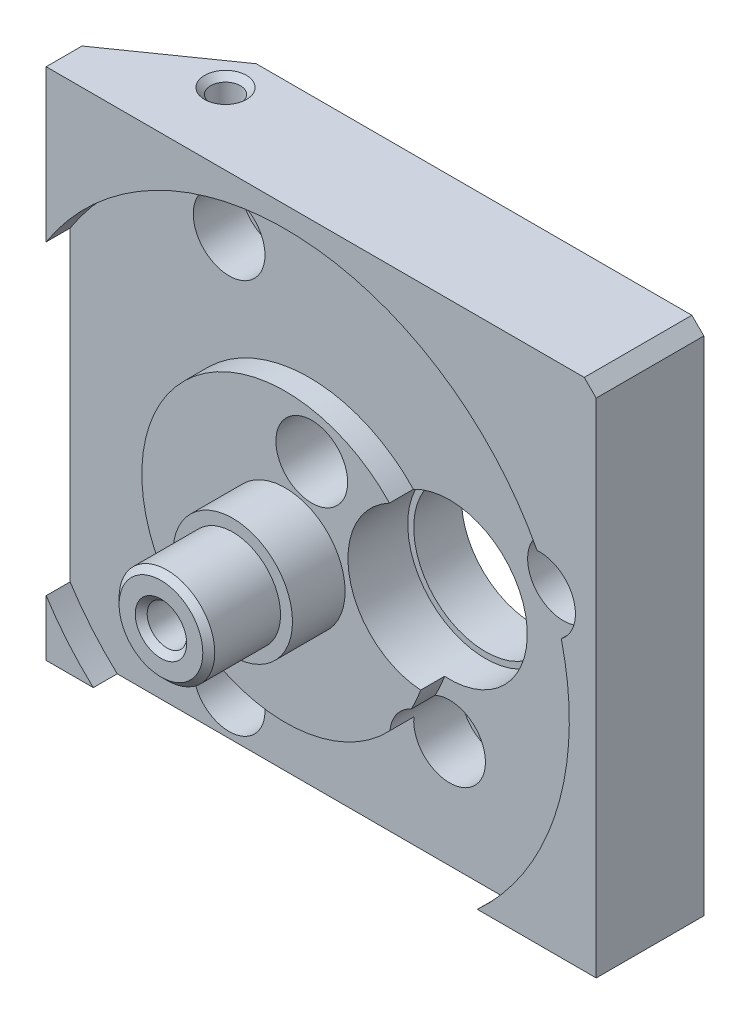
from build123d import *

# Parameters (mm, degrees)
SKETCH_1_W                 = 52
SKETCH_1_H                 = 45
EXTRUDE_1_DEPTH            = 9
SKETCH_19_R                = 23.75
SKETCH_19_R_2              = 12
CUT_EXTRUDE_2_DEPTH        = 2
SKETCH_20_R                = 5
EXTRUDE_3_DEPTH            = 4.4
SKETCH_21_R                = 4
EXTRUDE_4_DEPTH            = 6
SKETCH_22_R                = 6
CUT_EXTRUDE_5_DEPTH        = 36.922277211
HOLE_WIZARD_1_D            = 3.4
HOLE_WIZARD_1_CBORE_D      = 6
HOLE_WIZARD_1_CBORE_DEPTH  = 6
CUT_EXTRUDE_6_DEPTH        = 45
HOLE_WIZARD_M3_1_D         = 2.5
HOLE_WIZARD_M3_1_DEPTH     = 9.5
HOLE_WIZARD_M3_1_TIP       = 0.751075774
HOLE_WIZARD_M4_2_D         = 3.3
HOLE_WIZARD_M4_2_DEPTH     = 10.1
HOLE_WIZARD_M4_2_TIP       = 0.991420021
CHAMFER_3_SIZE             = 0.5
M3_TAPPED_HOLE2_D          = 2.5
M3_TAPPED_HOLE2_DEPTH      = 11.5
M3_TAPPED_HOLE2_TIP        = 0.751075774
CHAMFER_4_SIZE             = 0.5
CHAMFER_5_SIZE             = 0.5
CHAMFER_6_SIZE             = 1
HOLE_WIZARD_2_D            = 3.4
HOLE_WIZARD_2_CBORE_D      = 6
HOLE_WIZARD_2_CBORE_DEPTH  = 6
EXTRUDE3_DEPTH             = 2
CHAMFER3_SIZE              = 0.5
EXTRUDE4_REACH             = 55.864
SKETCH_34_R                = 1
CUT_EXTRUDE_1_DEPTH        = 4
CUT_EXTRUDE_2_2_DEPTH      = 6
CUT_EXTRUDE_2_2_DEPTH_BACK = 3
SKETCH_35_R                = 6.5


with BuildPart() as part:
    # 草图1 → 拉伸1 (new body)
    with BuildSketch(Plane.XY):
        Rectangle(SKETCH_1_W, SKETCH_1_H)
    extrude(amount=EXTRUDE_1_DEPTH)

    # 草图19 → Cut-Extrude 2 (cut)
    with BuildSketch(Plane.XY.offset(9)):
        with Locations((0, -3)):
            Circle(SKETCH_19_R)
        with Locations((0, -3)):
            Circle(SKETCH_19_R_2, mode=Mode.SUBTRACT)
    extrude(amount=-CUT_EXTRUDE_2_DEPTH, mode=Mode.SUBTRACT)

    # 草图20 → 拉伸3 (add)
    with BuildSketch(Plane.XY.offset(9)):
        with Locations((0, -3)):
            Circle(SKETCH_20_R)
    extrude(amount=EXTRUDE_3_DEPTH)

    # 草图21 → 拉伸4 (add)
    with BuildSketch(Plane.XY.offset(13.4)):
        with Locations((0, -3)):
            Circle(SKETCH_21_R)
    extrude(amount=EXTRUDE_4_DEPTH)

    # 草图22 → 拉伸5 (cut, through all)
    with BuildSketch(Plane.XY.offset(9)):
        with Locations((11.736694594, -0.5)):
            Circle(SKETCH_22_R)
    extrude(amount=-CUT_EXTRUDE_5_DEPTH, mode=Mode.SUBTRACT)

    # 打孔尺寸根据内六角圆柱头螺钉的类型1 (through all)
    with Locations(Plane(origin=(2.210415153, 5, 9), x_dir=(1, 0, 0), z_dir=(0, 0, 1))):
        with Locations((0, 0), (9.526279441, -16.5), (19.052558883, 0)):
            CounterBoreHole(HOLE_WIZARD_1_D / 2, HOLE_WIZARD_1_CBORE_D / 2, HOLE_WIZARD_1_CBORE_DEPTH)

    # 草图25 → 拉伸6 (cut)
    with BuildSketch(Plane.XZ.offset(22.5)):
        Polygon((-26, 8), (-14.574815946, 0), (-26, 0), align=None)
    extrude(amount=-CUT_EXTRUDE_6_DEPTH, mode=Mode.SUBTRACT)

    # M3 螺纹孔1
    with Locations(Plane(origin=(-11, 22.5, 3), x_dir=(0, 0, 1), z_dir=(0, 1, 0))):
        with Locations((0, 0)):
            Hole(HOLE_WIZARD_M3_1_D / 2, depth=HOLE_WIZARD_M3_1_DEPTH)
            with Locations((0, 0, -(HOLE_WIZARD_M3_1_DEPTH + HOLE_WIZARD_M3_1_TIP / 2))):  # 118° drill point
                Cone(0, HOLE_WIZARD_M3_1_D / 2, HOLE_WIZARD_M3_1_TIP, mode=Mode.SUBTRACT)

    # M4 螺纹孔2
    with Locations(Plane(origin=(0, -3, 19.4), x_dir=(1, 0, 0), z_dir=(0, 0, 1))):
        with Locations((0, 0)):
            Hole(HOLE_WIZARD_M4_2_D / 2, depth=HOLE_WIZARD_M4_2_DEPTH)
            with Locations((0, 0, -(HOLE_WIZARD_M4_2_DEPTH + HOLE_WIZARD_M4_2_TIP / 2))):  # 118° drill point
                Cone(0, HOLE_WIZARD_M4_2_D / 2, HOLE_WIZARD_M4_2_TIP, mode=Mode.SUBTRACT)

    # 倒角3
    chamfer_3_edges = [part.edges().sort_by_distance(p)[0] for p in [
        (-4, -3, 19.4),
        (1.65, -3, 19.4),
    ]]
    chamfer(chamfer_3_edges, length=CHAMFER_3_SIZE)

    # M3 Tapped Hole2
    with Locations(Plane(origin=(-11, -22.5, 3), x_dir=(0, 0, -1), z_dir=(0, -1, 0))):
        with Locations((0, 0), (0, 35)):
            Hole(M3_TAPPED_HOLE2_D / 2, depth=M3_TAPPED_HOLE2_DEPTH)
            with Locations((0, 0, -(M3_TAPPED_HOLE2_DEPTH + M3_TAPPED_HOLE2_TIP / 2))):  # 118° drill point
                Cone(0, M3_TAPPED_HOLE2_D / 2, M3_TAPPED_HOLE2_TIP, mode=Mode.SUBTRACT)

    # 倒角4
    chamfer_4_edges = [part.edges().sort_by_distance(p)[0] for p in [
        (-11, -22.5, 1.75),
        (-11, 22.5, 4.25),
    ]]
    chamfer(chamfer_4_edges, length=CHAMFER_4_SIZE)

    # 倒角5
    chamfer_5_edges = [part.edges().sort_by_distance(p)[0] for p in [
        (24, -22.5, 1.75),
    ]]
    chamfer(chamfer_5_edges, length=CHAMFER_5_SIZE)

    # 倒角6
    chamfer_6_edges = [part.edges().sort_by_distance(p)[0] for p in [
        (26, 22.5, 4.5),
    ]]
    chamfer(chamfer_6_edges, length=CHAMFER_6_SIZE)

    # 打孔尺寸根据内六角圆柱头螺钉的类型2 (through all)
    with Locations(Plane(origin=(-6.7, 16, 9), x_dir=(1, 0, 0), z_dir=(0, 0, 1))):
        with Locations((0, 0), (0, -33)):
            CounterBoreHole(HOLE_WIZARD_2_D / 2, HOLE_WIZARD_2_CBORE_D / 2, HOLE_WIZARD_2_CBORE_DEPTH)

    # Sketch6 → Extrude3 (cut)
    with BuildSketch(Plane.XZ.offset(22.5)):
        Polygon((-26, 9), (-26, 8), (-14.574815946, 0), (26, 0), (26, 9), (13.557746863, 9), (13.557746863, 7), (-13.557746863, 7), (-13.557746863, 9), align=None)
    extrude(amount=-EXTRUDE3_DEPTH, mode=Mode.SUBTRACT)

    # Chamfer3
    chamfer3_edges = [part.edges().sort_by_distance(p)[0] for p in [
        (24, -20.5, 1.75),
        (-11, -20.5, 1.75),
    ]]
    chamfer(chamfer3_edges, length=CHAMFER3_SIZE)

    # Extrude4: up to this face of the body (flat: up to its plane)
    extrude4_end = Plane(part.part.faces().sort_by_distance((2.205978038, 22.5, 4.743303676))[0])
    # Sketch7 → Extrude4 (cut, up to the picked face)
    with BuildSketch(Plane.XZ.offset(20.5), mode=Mode.PRIVATE) as extrude4_sk1:
        Polygon((-20, 9), (-20, 6), (-11.43111196, 0), (-14.574815946, 0), (-26, 8), (-26, 9), align=None)
    extrude4_tool1 = split(extrude(extrude4_sk1.sketch, amount=-EXTRUDE4_REACH, mode=Mode.PRIVATE), bisect_by=extrude4_end, keep=Keep.BOTH, mode=Mode.PRIVATE)
    add(extrude4_tool1.solids().sort_by(Axis((-19.659359, -20.5, 5.073959), (0, 1, 0)))[0], mode=Mode.SUBTRACT)

    # 草图34 → 切除-拉伸1 (cut)
    with BuildSketch(Plane.XZ.offset(20.5)):
        with Locations(Location((-1, 3, 0), (0, 0, 270))):
            Circle(SKETCH_34_R)
        with Locations(Location((14, 3, 0), (0, 0, 270))):
            Circle(SKETCH_34_R)
    extrude(amount=-CUT_EXTRUDE_1_DEPTH, mode=Mode.SUBTRACT)

    # 草图35 → Cut-Extrude 2 2 (cut, two sides: drawn at the far end of the back side and taken through both)
    with BuildSketch(Plane.XY.offset(7).offset(-CUT_EXTRUDE_2_2_DEPTH_BACK)):
        with Locations(Location((11.736694594, -0.5, 0), (0, 0, 117.738560229))):
            Circle(SKETCH_35_R)
    extrude(amount=CUT_EXTRUDE_2_2_DEPTH + CUT_EXTRUDE_2_2_DEPTH_BACK, mode=Mode.SUBTRACT)


solid = part.part
